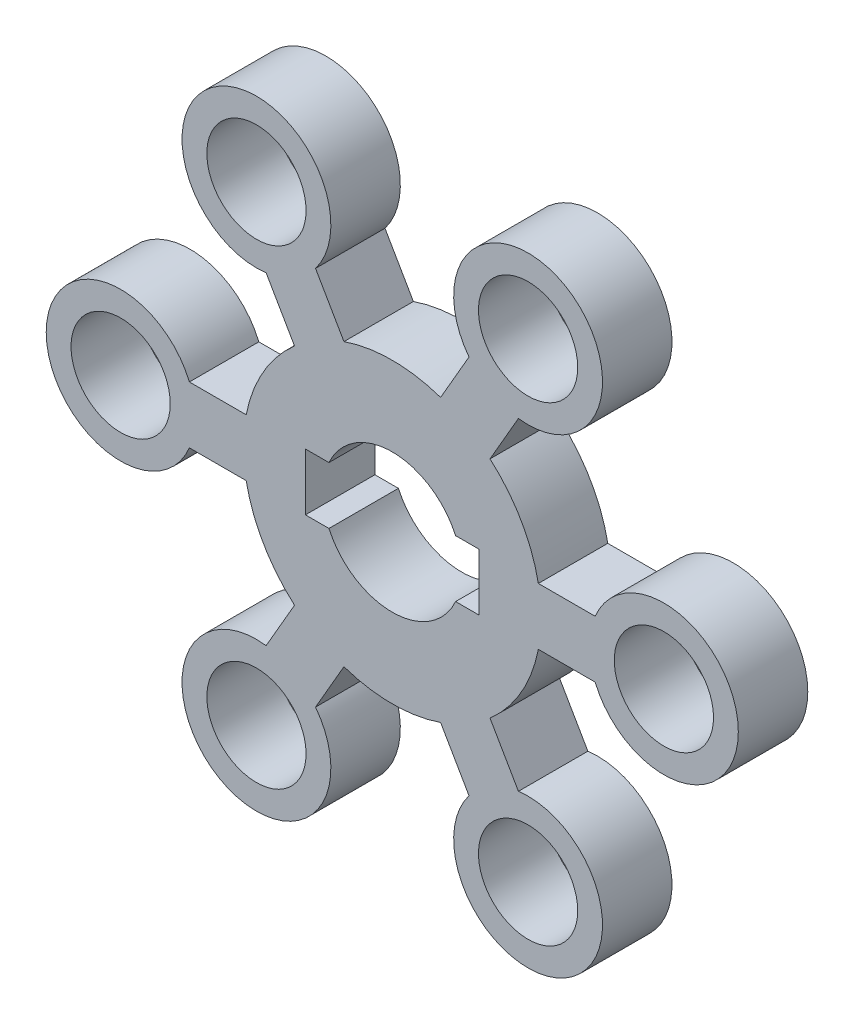
from build123d import *

# Parameters (mm, degrees)
SKETCH1_R           = 20
BOSS_EXTRUDE1_DEPTH = 14


with BuildPart() as part:
    # Sketch1 → Boss-Extrude1 (new, symmetric)
    with BuildSketch(Plane.XY):
        with BuildLine():
            Line((58.887604808, 11.5), (81.791697995, 11.5))
            ThreePointArc((81.791697995, 11.5), (139.5, 0), (81.791697995, -11.5))
            Line((81.791697995, -11.5), (58.887604808, -11.5))
            ThreePointArc((58.887604808, -11.5), (51.961524227, -30), (39.403094547, -45.248161732))
            Line((39.403094547, -45.248161732), (50.855141141, -65.083688282))
            ThreePointArc((50.855141141, -65.083688282), (69.75, -120.810543828), (30.936556854, -76.583688282))
            Line((30.936556854, -76.583688282), (19.48451026, -56.748161732))
            ThreePointArc((19.48451026, -56.748161732), (0, -60), (-19.48451026, -56.748161732))
            Line((-19.48451026, -56.748161732), (-30.936556854, -76.583688282))
            ThreePointArc((-30.936556854, -76.583688282), (-69.75, -120.810543828), (-50.855141141, -65.083688282))
            Line((-50.855141141, -65.083688282), (-39.403094547, -45.248161732))
            ThreePointArc((-39.403094547, -45.248161732), (-51.961524227, -30), (-58.887604808, -11.5))
            Line((-58.887604808, -11.5), (-81.791697995, -11.5))
            ThreePointArc((-81.791697995, -11.5), (-139.5, 0), (-81.791697995, 11.5))
            Line((-81.791697995, 11.5), (-58.887604808, 11.5))
            ThreePointArc((-58.887604808, 11.5), (-51.961524227, 30), (-39.403094547, 45.248161732))
            Line((-39.403094547, 45.248161732), (-50.855141141, 65.083688282))
            ThreePointArc((-50.855141141, 65.083688282), (-69.75, 120.810543828), (-30.936556854, 76.583688282))
            Line((-30.936556854, 76.583688282), (-19.48451026, 56.748161732))
            ThreePointArc((-19.48451026, 56.748161732), (0, 60), (19.48451026, 56.748161732))
            Line((19.48451026, 56.748161732), (30.936556854, 76.583688282))
            ThreePointArc((30.936556854, 76.583688282), (69.75, 120.810543828), (50.855141141, 65.083688282))
            Line((50.855141141, 65.083688282), (39.403094547, 45.248161732))
            ThreePointArc((39.403094547, 45.248161732), (51.961524227, 30), (58.887604808, 11.5))
        make_face()
        with Locations((109.5, 0)):
            Circle(SKETCH1_R, mode=Mode.SUBTRACT)
        with Locations((54.75, -94.829781714)):
            Circle(SKETCH1_R, mode=Mode.SUBTRACT)
        with Locations((-54.75, -94.829781714)):
            Circle(SKETCH1_R, mode=Mode.SUBTRACT)
        with Locations((-109.5, 0)):
            Circle(SKETCH1_R, mode=Mode.SUBTRACT)
        with Locations((-54.75, 94.829781714)):
            Circle(SKETCH1_R, mode=Mode.SUBTRACT)
        with Locations((54.75, 94.829781714)):
            Circle(SKETCH1_R, mode=Mode.SUBTRACT)
        with BuildLine():
            Line((-25.529394822, 11.5), (-35, 11.5))
            Line((-35, 11.5), (-35, -11.5))
            Line((-35, -11.5), (-25.529394822, -11.5))
            ThreePointArc((-25.529394822, -11.5), (0, -28), (25.529394822, -11.5))
            Line((25.529394822, -11.5), (35, -11.5))
            Line((35, -11.5), (35, 11.5))
            Line((35, 11.5), (25.529394822, 11.5))
            ThreePointArc((25.529394822, 11.5), (0, 28), (-25.529394822, 11.5))
        make_face(mode=Mode.SUBTRACT)
    extrude(amount=BOSS_EXTRUDE1_DEPTH, both=True)


solid = part.part
